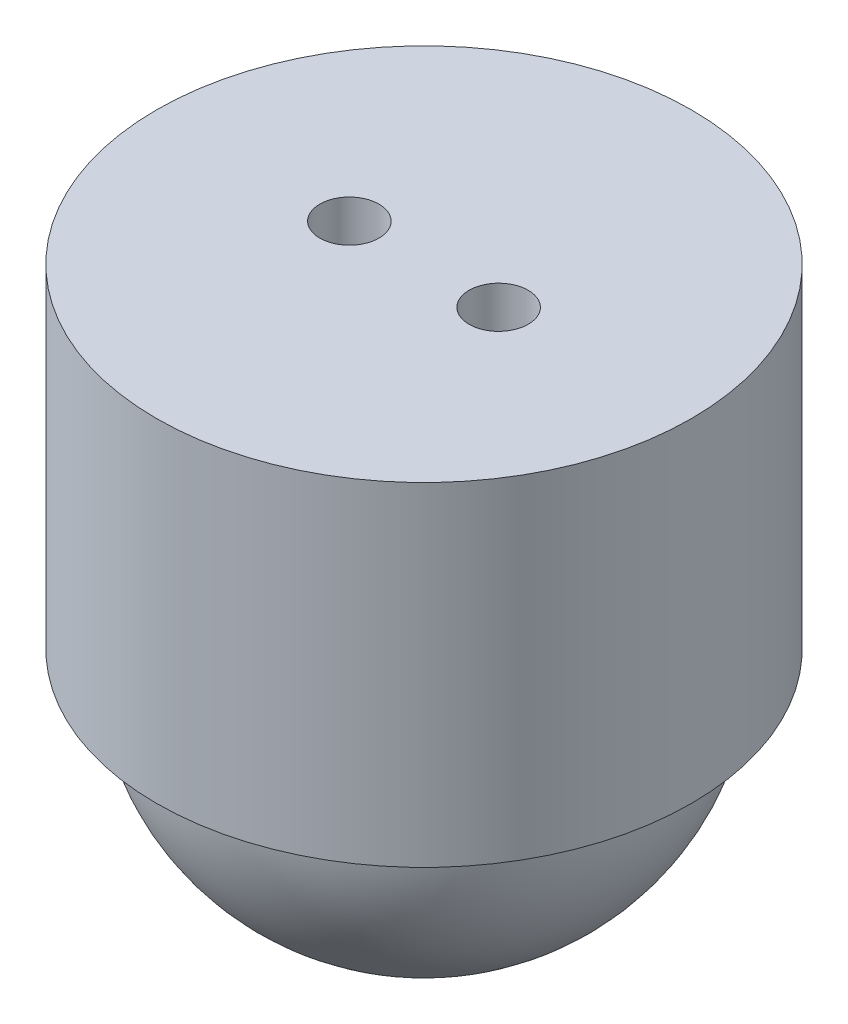
from build123d import *

# Parameters (mm, degrees)
CROQUIS7_R              = 10.922
SALIENTE_EXTRUIR2_DEPTH = 13.614
CROQUIS8_R              = 1.2065
CORTAR_EXTRUIR3_DEPTH   = 13.614


with BuildPart() as part:
    # Croquis1 → Revolución1 (revolve)
    with BuildSketch(Plane.XY):
        with BuildLine():
            Line((-9.5, 0), (9.5, 0))
            ThreePointArc((9.5, 0), (0, 9.5), (-9.5, 0))
        make_face()
    revolve(axis=Axis((-9.5, 0, 0), (1, 0, 0)))

    # Croquis7 → Saliente-Extruir2 (add)
    with BuildSketch(Plane(origin=(0, 0, 0), x_dir=(1, 0, 0), z_dir=(0, 1, 0))):
        with Locations(Location((0, 0, 0), (0, 0, 270))):
            Circle(CROQUIS7_R)
    extrude(amount=SALIENTE_EXTRUIR2_DEPTH)

    # Croquis8 → Cortar-Extruir3 (cut)
    with BuildSketch(Plane(origin=(0, 13.614, 0), x_dir=(1, 0, 0), z_dir=(0, 1, 0))):
        with Locations(Location((-3.048, 0, 0), (0, 0, 270))):
            Circle(CROQUIS8_R)
        with Locations(Location((3.048, 0, 0), (0, 0, 90))):
            Circle(CROQUIS8_R)
    extrude(amount=-CORTAR_EXTRUIR3_DEPTH, mode=Mode.SUBTRACT)


solid = part.part
